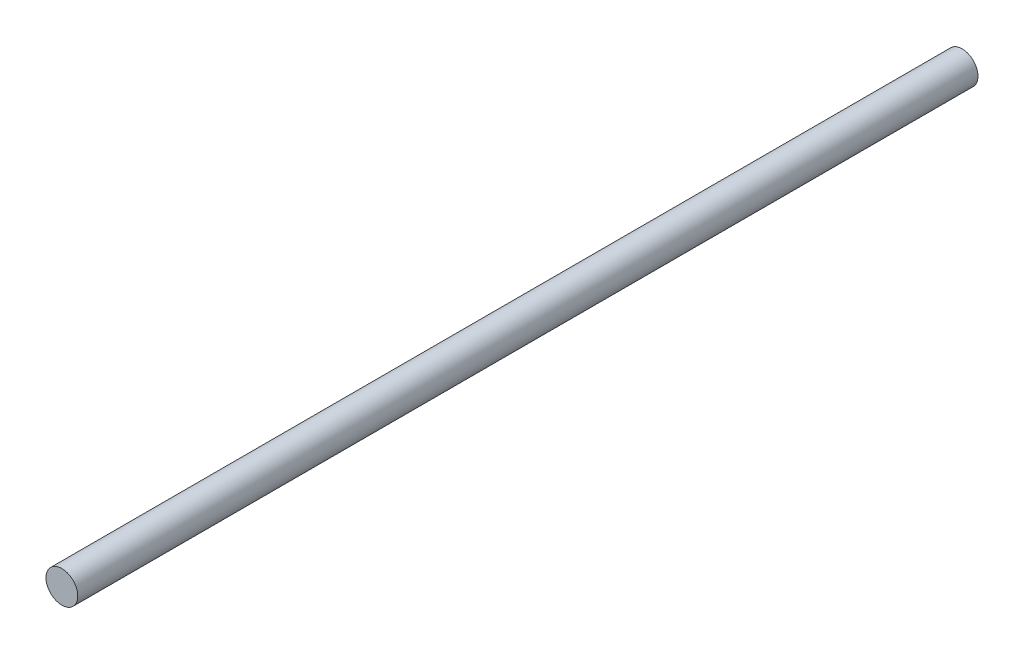
from build123d import *

# Parameters (mm, degrees)
SKETCH1_R           = 3
BOSS_EXTRUDE2_DEPTH = 170


with BuildPart() as part:
    # Sketch1 → Boss-Extrude2 (new body)
    with BuildSketch(Plane.XY):
        Circle(SKETCH1_R)
    extrude(amount=BOSS_EXTRUDE2_DEPTH)


solid = part.part
